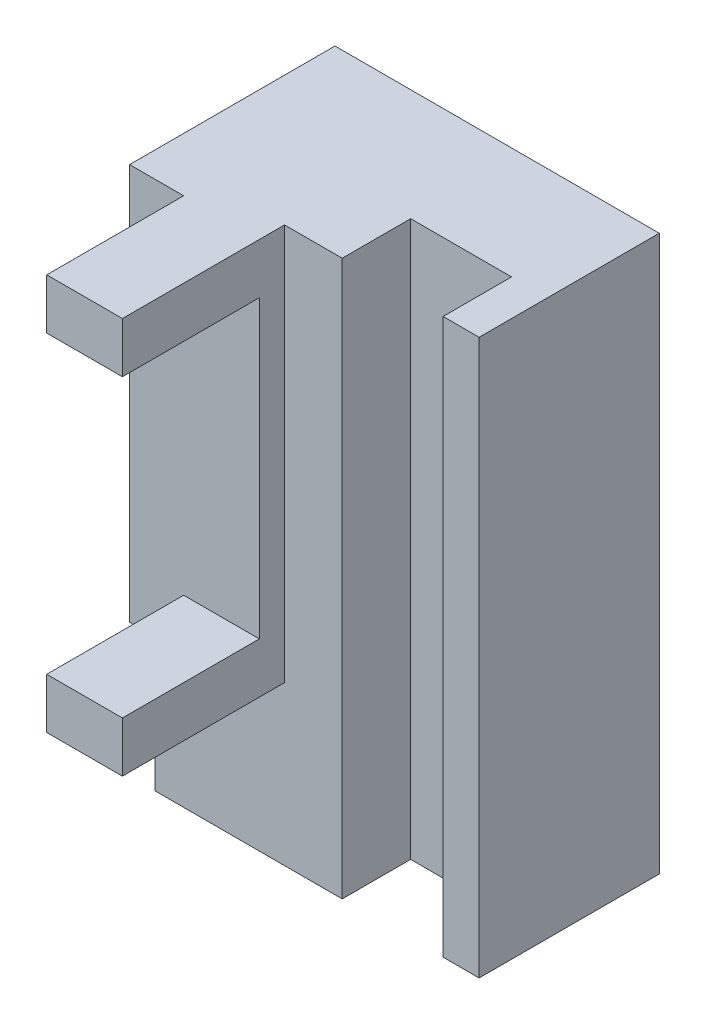
from build123d import *

# Parameters (mm, degrees)
SKETCH4_W           = 45
SKETCH4_H           = 77
BOSS_EXTRUDE1_DEPTH = 25
SKETCH6_W           = 14
SKETCH6_H           = 9.5
CUT_EXTRUDE1_DEPTH  = 86.919604617
SKETCH7_W           = 10.5
SKETCH7_H           = 55
BOSS_EXTRUDE2_DEPTH = 3.5
SKETCH8_W           = 10.5
SKETCH8_H           = 7
BOSS_EXTRUDE3_DEPTH = 19
SKETCH9_W           = 7.5
SKETCH9_H           = 55
BOSS_EXTRUDE4_DEPTH = 3.5


with BuildPart() as part:
    # Sketch4 → Boss-Extrude1 (new body)
    with BuildSketch(Plane.XY):
        with Locations((-6.278089888, 17.075842697)):
            Rectangle(SKETCH4_W, SKETCH4_H)
    extrude(amount=BOSS_EXTRUDE1_DEPTH)

    # Sketch6 → Cut-Extrude1 (cut, through all)
    with BuildSketch(Plane.XZ.offset(21.424157303)):
        with Locations((4.221910112, 20.25)):
            Rectangle(SKETCH6_W, SKETCH6_H)
    extrude(amount=-CUT_EXTRUDE1_DEPTH, mode=Mode.SUBTRACT)

    # Sketch7 → Boss-Extrude2 (add)
    with BuildSketch(Plane.XY.offset(25)):
        with Locations((-16.028089888, 28.075842697)):
            Rectangle(SKETCH7_W, SKETCH7_H)
    extrude(amount=BOSS_EXTRUDE2_DEPTH)

    # Sketch8 → Boss-Extrude3 (add)
    with BuildSketch(Plane.XY.offset(28.5)):
        with Locations((-16.028089888, 4.075842697)):
            Rectangle(SKETCH8_W, SKETCH8_H)
        with Locations((-16.028089888, 52.075842697)):
            Rectangle(SKETCH8_W, SKETCH8_H)
    extrude(amount=BOSS_EXTRUDE3_DEPTH)

    # Sketch9 → Boss-Extrude4 (add)
    with BuildSketch(Plane.XY.offset(25)):
        with Locations((-25.028089888, 28.075842697)):
            Rectangle(SKETCH9_W, SKETCH9_H)
    extrude(amount=BOSS_EXTRUDE4_DEPTH)


solid = part.part
